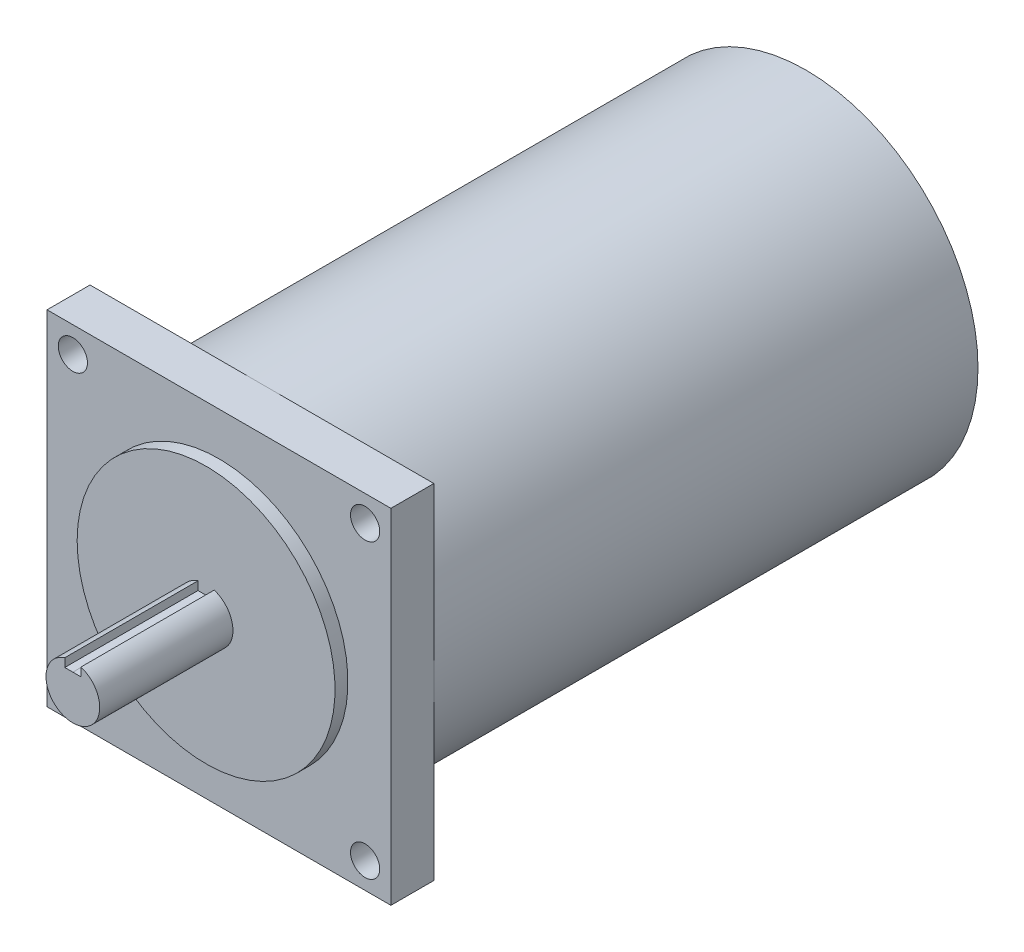
from build123d import *

# Parameters (mm, degrees)
SKETCH1_W               = 101.6
SKETCH1_H               = 101.6
SKETCH1_R               = 4.318
BOSS_EXTRUDE1_DEPTH     = 12.7
SKETCH2_R               = 38.1
BOSS_EXTRUDE2_DEPTH     = 3.81
SKETCH4_R               = 7.9375
BOSS_EXTRUDE4_DEPTH     = 39.37
CUT_EXTRUDE1_DEPTH      = 92.015682165
CUT_EXTRUDE1_DEPTH_BACK = 39.37
SKETCH6_R               = 50.8
BOSS_EXTRUDE5_DEPTH     = 160.782
BOSS_EXTRUDE6_START     = 3.81
SKETCH7_R               = 38.1
BOSS_EXTRUDE6_DEPTH     = 3.81
SKETCH8_R               = 6.35
BOSS_EXTRUDE7_DEPTH     = 17.78


with BuildPart() as part:
    # Sketch1 → Boss-Extrude1 (new body)
    with BuildSketch(Plane.XY):
        Rectangle(SKETCH1_W, SKETCH1_H)
        with Locations((-43.18, -43.18)):
            Circle(SKETCH1_R, mode=Mode.SUBTRACT)
        with Locations((43.18, -43.18)):
            Circle(SKETCH1_R, mode=Mode.SUBTRACT)
        with Locations((43.18, 43.18)):
            Circle(SKETCH1_R, mode=Mode.SUBTRACT)
        with Locations((-43.18, 43.18)):
            Circle(SKETCH1_R, mode=Mode.SUBTRACT)
    extrude(amount=BOSS_EXTRUDE1_DEPTH)

    # Sketch2 → Boss-Extrude2 (add)
    with BuildSketch(Plane.XY.offset(12.7)):
        with Locations(Location((0, 0, 0), (0, 0, 180))):
            Circle(SKETCH2_R)
    extrude(amount=BOSS_EXTRUDE2_DEPTH)

    # Sketch4 → Boss-Extrude4 (add)
    with BuildSketch(Plane.XY.offset(16.51)):
        Circle(SKETCH4_R)
    extrude(amount=BOSS_EXTRUDE4_DEPTH)

    # Sketch5 → Cut-Extrude1 (cut, two sides: drawn at the far end of the back side and taken through both)
    with BuildSketch(Plane.XY.offset(55.88).offset(-CUT_EXTRUDE1_DEPTH_BACK)):
        with BuildLine():
            Line((-2.387594518, 5.063803231), (5.482e-06, 5.063803231))
            Line((5.482e-06, 5.063803231), (2.387605482, 5.063803231))
            Line((2.387605482, 5.063803231), (2.387605482, 7.569890773))
            ThreePointArc((2.387605482, 7.569890773), (5.748e-06, 7.9375), (-2.387594518, 7.569894231))
            Line((-2.387594518, 7.569894231), (-2.387594518, 5.063803231))
        make_face()
    extrude(amount=CUT_EXTRUDE1_DEPTH + CUT_EXTRUDE1_DEPTH_BACK, mode=Mode.SUBTRACT)

    # Sketch6 → Boss-Extrude5 (add)
    with BuildSketch(Plane(origin=(0, 0, 0), x_dir=(-1, 0, 0), z_dir=(0, 0, -1))):
        Circle(SKETCH6_R)
    extrude(amount=BOSS_EXTRUDE5_DEPTH)

    # Sketch7 → Boss-Extrude6 (add)
    with BuildSketch(Plane(origin=(0, 0, -160.782), x_dir=(-1, 0, 0), z_dir=(0, 0, -1)).offset(BOSS_EXTRUDE6_START)):
        Circle(SKETCH7_R)
    extrude(amount=-BOSS_EXTRUDE6_DEPTH)

    # Sketch8 → Boss-Extrude7 (add)
    with BuildSketch(Plane(origin=(0, 0, -164.592), x_dir=(-1, 0, 0), z_dir=(0, 0, -1))):
        Circle(SKETCH8_R)
    extrude(amount=BOSS_EXTRUDE7_DEPTH)


solid = part.part
